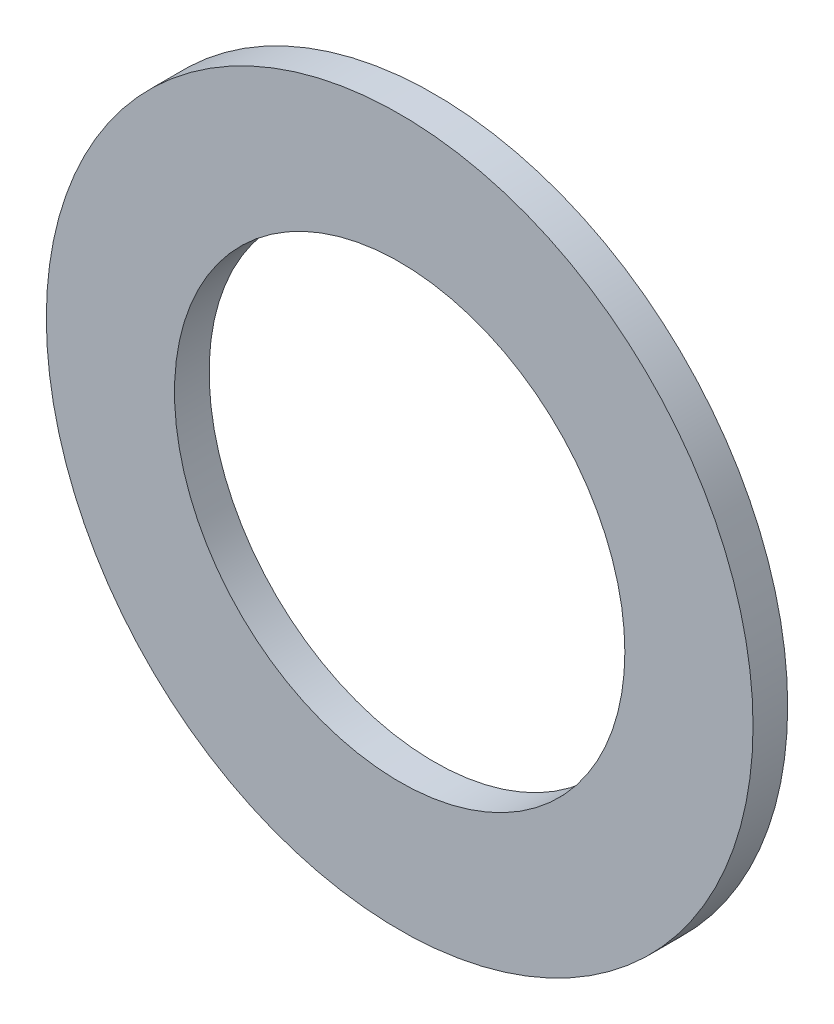
from build123d import *

# Parameters (mm, degrees)
SKETCH1_R           = 5.1
SKETCH1_R_2         = 3.25
BOSS_EXTRUDE1_DEPTH = 0.5


with BuildPart() as part:
    # Sketch1 → Boss-Extrude1 (new body)
    with BuildSketch(Plane.XY):
        Circle(SKETCH1_R)
        Circle(SKETCH1_R_2, mode=Mode.SUBTRACT)
    extrude(amount=BOSS_EXTRUDE1_DEPTH)


solid = part.part
